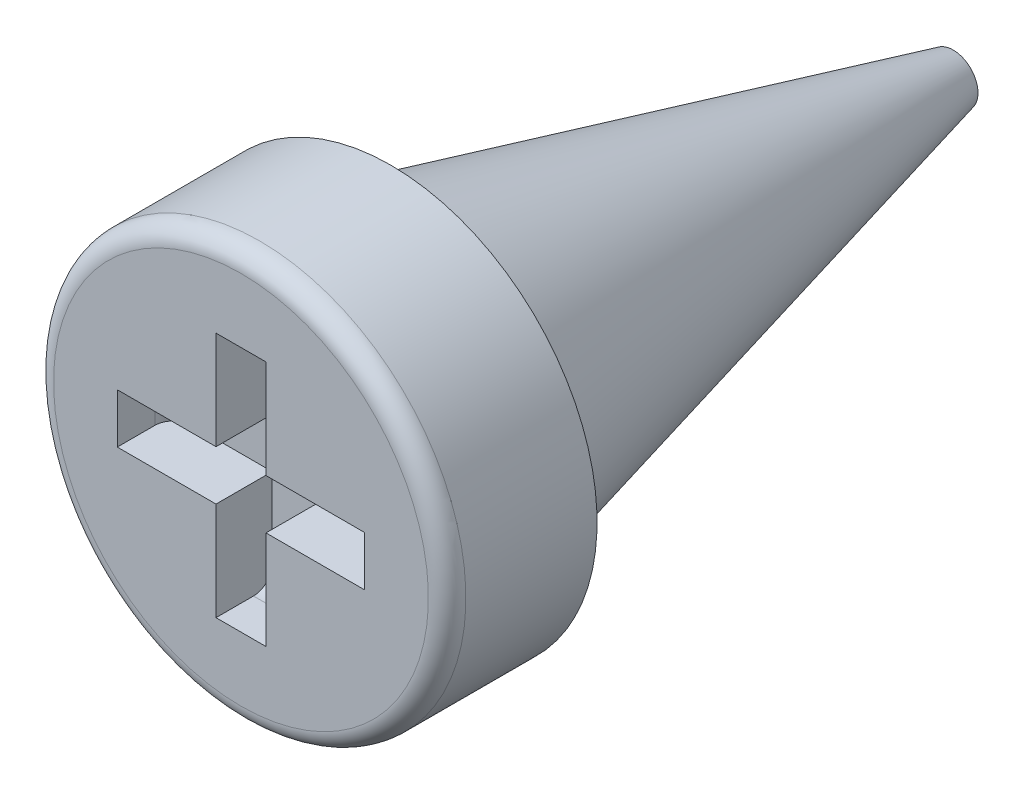
from build123d import *

# Parameters (mm, degrees)
ENL_V_MAT_EXTRU_2_DEPTH = 0.72
CONG_4_R                = 0.24


with BuildPart() as part:
    # Esquisse1 → Révolution1 (revolve)
    with BuildSketch(Plane(origin=(0, 0, 0), x_dir=(0, 0, -1), z_dir=(1, 0, 0))):
        with BuildLine():
            Line((9.12, 0), (0, 0))
            Line((0, 0), (0, 2.4))
            ThreePointArc((0, 2.4), (0.070294373, 2.569705627), (0.24, 2.64))
            Line((0.24, 2.64), (1.92, 2.64))
            Line((1.92, 2.64), (1.92, 2.11316162))
            Line((1.92, 2.11316162), (9.12, 0.318))
            Line((9.12, 0.318), (9.12, 0))
        make_face()
    revolve(axis=Axis((0, 0, -9.12), (0, 0, 1)))

    # Esquisse3 → Enlèv. mat.-Extru.2 (cut)
    with BuildSketch(Plane.XY):
        Polygon((0.32, 1.578), (-0.32, 1.578), (-0.32, 0.318), (-1.584, 0.318), (-1.584, -0.318), (-0.32, -0.318), (-0.32, -1.578), (0.32, -1.578), (0.32, -0.318), (1.584, -0.318), (1.584, 0.318), (0.32, 0.318), align=None)
    extrude(amount=-ENL_V_MAT_EXTRU_2_DEPTH, mode=Mode.SUBTRACT)

    # Congé4
    cong_4_edges = [part.edges().sort_by_distance(p)[0] for p in [
        (0, -1.578, -0.72),
        (-1.584, 0, -0.72),
        (0, 1.578, -0.72),
        (1.584, 0, -0.72),
    ]]
    fillet(cong_4_edges, radius=CONG_4_R)


solid = part.part
